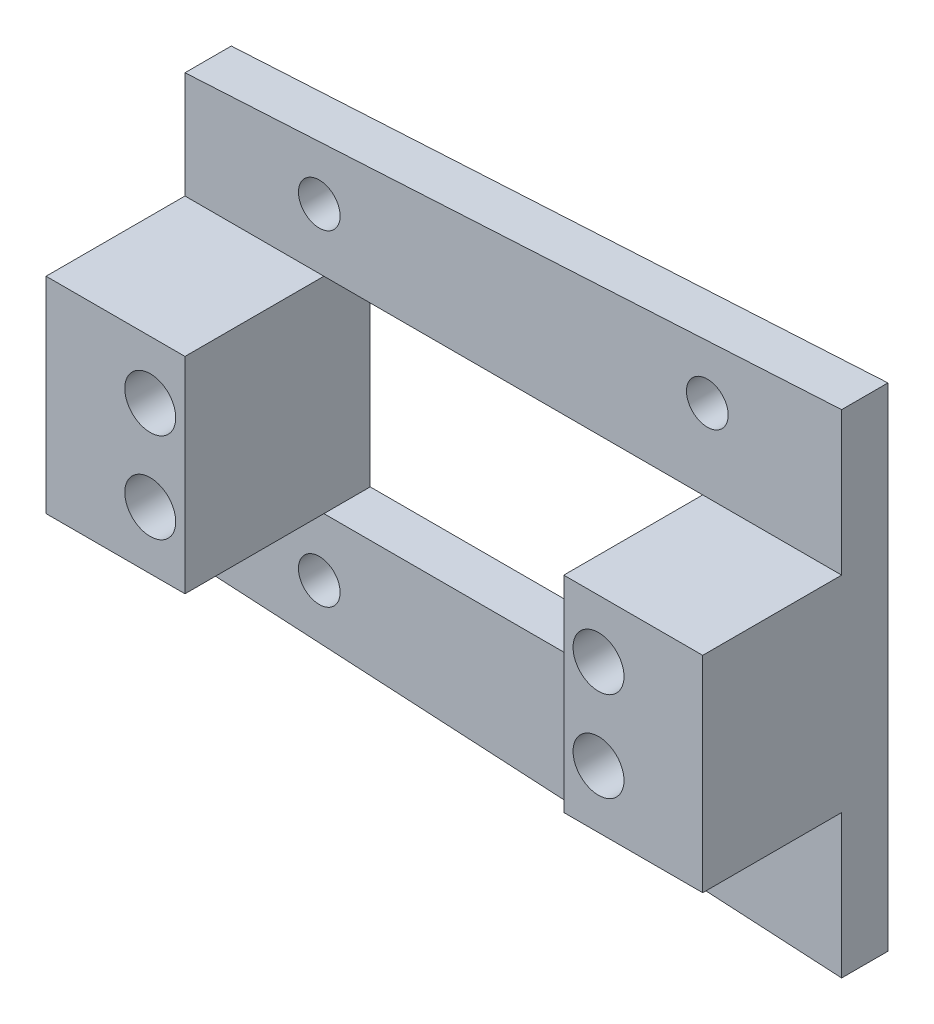
from build123d import *

# Parameters (mm, degrees)
SKETCH1_W           = 40.9
SKETCH1_H           = 22.2
SKETCH1_R           = 2.25
SKETCH1_R_2         = 2.75
BOSS_EXTRUDE4_DEPTH = 20
SKETCH4_W           = 70.9
SKETCH4_H           = 15.47309833
CUT_EXTRUDE1_DEPTH  = 15


with BuildPart() as part:
    # Sketch1 → Boss-Extrude4 (new body)
    with BuildSketch(Plane.XY):
        Polygon((-35.45, 22.62690167), (-35.45, -22.62690167), (35.45, -26.57309833), (35.45, 26.57309833), align=None)
        Rectangle(SKETCH1_W, SKETCH1_H, mode=Mode.SUBTRACT)
        with Locations((-20.95, 17.6)):
            Circle(SKETCH1_R, mode=Mode.SUBTRACT)
        with Locations((20.95, 19.932096475)):
            Circle(SKETCH1_R, mode=Mode.SUBTRACT)
        with Locations((-24.2, 4.86)):
            Circle(SKETCH1_R_2, mode=Mode.SUBTRACT)
        with Locations((-24.2, -4.86)):
            Circle(SKETCH1_R_2, mode=Mode.SUBTRACT)
        with Locations((24.2, 4.86)):
            Circle(SKETCH1_R_2, mode=Mode.SUBTRACT)
        with Locations((24.2, -4.86)):
            Circle(SKETCH1_R_2, mode=Mode.SUBTRACT)
        with Locations((20.95, -19.932096475)):
            Circle(SKETCH1_R, mode=Mode.SUBTRACT)
        with Locations((-20.95, -17.6)):
            Circle(SKETCH1_R, mode=Mode.SUBTRACT)
    extrude(amount=BOSS_EXTRUDE4_DEPTH)

    # Sketch4 → Cut-Extrude1 (cut)
    with BuildSketch(Plane.XY.offset(20)):
        with Locations((0, 18.836549165)):
            Rectangle(SKETCH4_W, SKETCH4_H)
        with Locations((0, -18.836549165)):
            Rectangle(SKETCH4_W, SKETCH4_H)
    extrude(amount=-CUT_EXTRUDE1_DEPTH, mode=Mode.SUBTRACT)


solid = part.part
